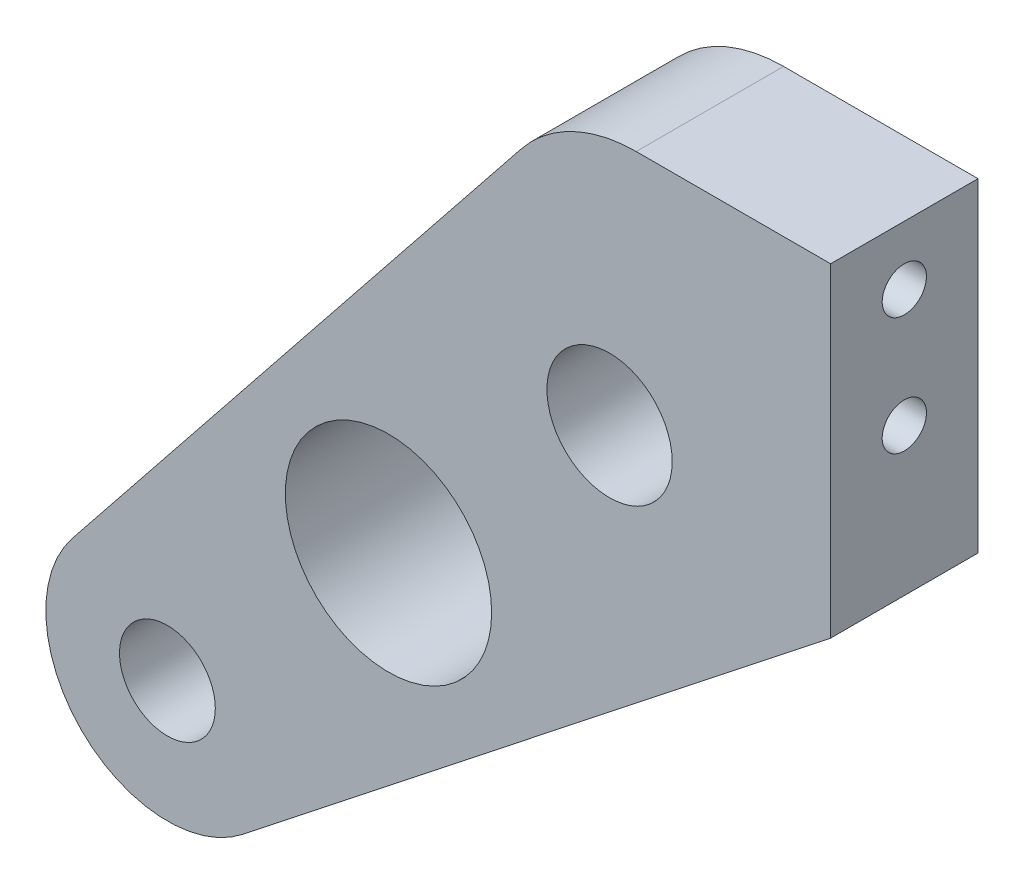
from build123d import *

# Parameters (mm, degrees)
SKETCH1_R           = 3.25
SKETCH1_R_2         = 4.25
SKETCH1_R_3         = 7
BOSS_EXTRUDE1_DEPTH = 10
SKETCH2_R           = 1.5
CUT_EXTRUDE1_DEPTH  = 10
FILLET1_R           = 10


with BuildPart() as part:
    # Sketch1 → Boss-Extrude1 (new body)
    with BuildSketch(Plane.XY):
        with BuildLine():
            Line((5.110545705, -6.47648227), (45, 25))
            Line((45, 25), (45, 47))
            Line((45, 47), (27, 47))
            Line((27, 47), (-6.444784556, 5.150461341))
            ThreePointArc((-6.444784556, 5.150461341), (-5.851623942, -5.815582279), (5.110545705, -6.47648227))
        make_face()
        Circle(SKETCH1_R, mode=Mode.SUBTRACT)
        with Locations((30, 30)):
            Circle(SKETCH1_R_2, mode=Mode.SUBTRACT)
        with Locations((15, 15)):
            Circle(SKETCH1_R_3, mode=Mode.SUBTRACT)
    extrude(amount=BOSS_EXTRUDE1_DEPTH)

    # Sketch2 → Cut-Extrude1 (cut)
    with BuildSketch(Plane(origin=(45, 0, 0), x_dir=(0, 0, -1), z_dir=(1, 0, 0))):
        with Locations((-5, 43)):
            Circle(SKETCH2_R)
        with Locations((-5, 35)):
            Circle(SKETCH2_R)
    extrude(amount=-CUT_EXTRUDE1_DEPTH, mode=Mode.SUBTRACT)

    # Fillet1
    fillet1_edges = [part.edges().sort_by_distance(p)[0] for p in [
        (27, 47, 5),
    ]]
    fillet(fillet1_edges, radius=FILLET1_R)


solid = part.part
